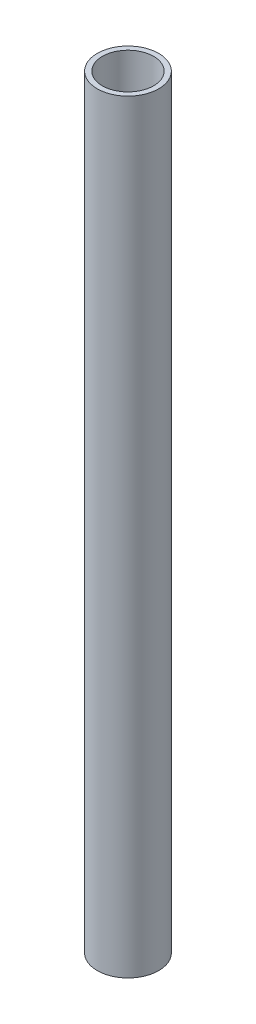
from build123d import *

# Parameters (mm, degrees)
SKETCH_1_R      = 15
SKETCH_1_R_2    = 12.5
EXTRUDE_1_DEPTH = 373


with BuildPart() as part:
    # Эскиз1 → Вытянуть1 (new body)
    with BuildSketch(Plane(origin=(0, 0, 0), x_dir=(1, 0, 0), z_dir=(0, 1, 0))):
        with Locations(Location((0, 0, 0), (0, 0, 270))):
            Circle(SKETCH_1_R)
        with Locations(Location((0, 0, 0), (0, 0, 270))):
            Circle(SKETCH_1_R_2, mode=Mode.SUBTRACT)
    extrude(amount=EXTRUDE_1_DEPTH)


solid = part.part
